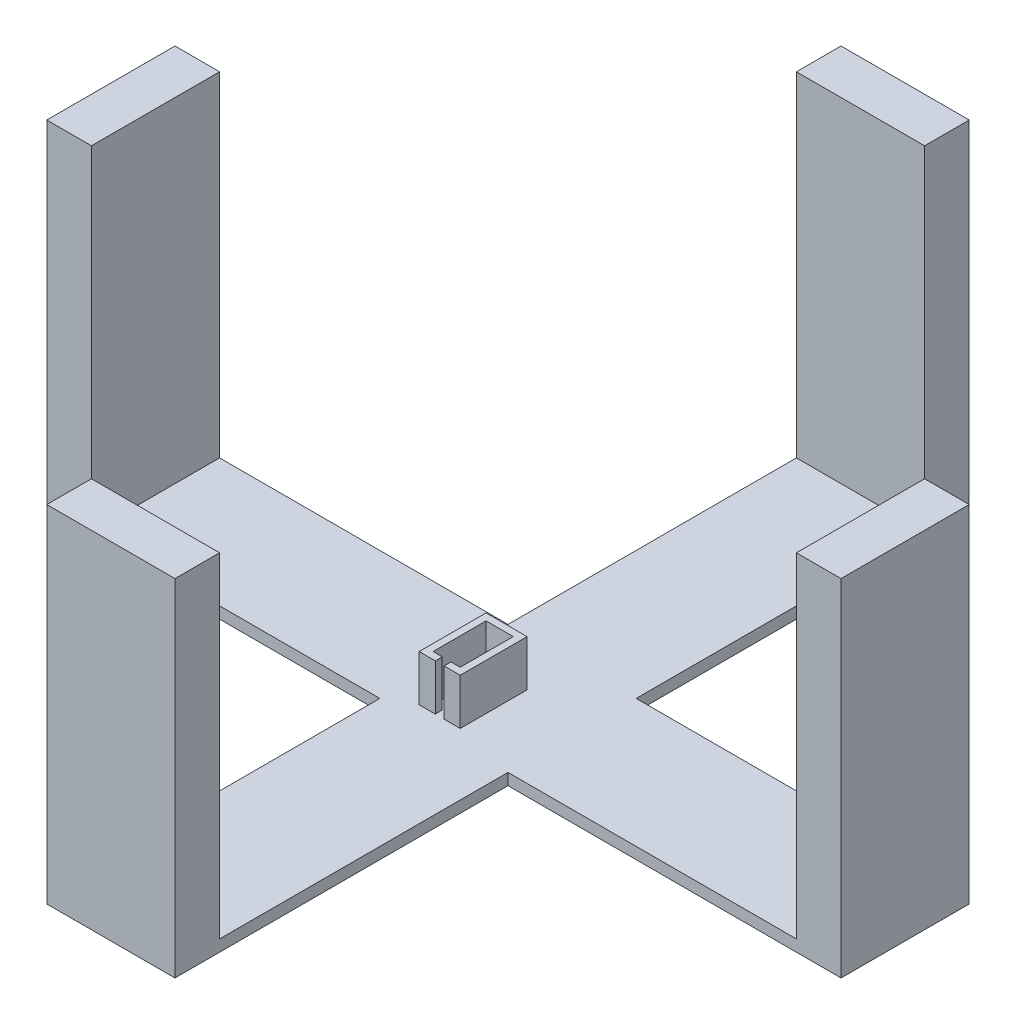
from build123d import *

# Parameters (mm, degrees)
SKETCH6_R            = 27.79
BOSS_EXTRUDE3_DEPTH  = 2
SKETCH5_W            = 125.058776632
SKETCH5_H            = 55.581678504
BOSS_EXTRUDE9_DEPTH  = 5
CIRPATTERN7_COUNT    = 4
SKETCH14_W           = 19.351012163
SKETCH14_H           = 55.581678504
BOSS_EXTRUDE10_DEPTH = 150
CIRPATTERN9_COUNT    = 4
SKETCH15_W           = 55.58
SKETCH15_H           = 55.58
BOSS_EXTRUDE11_DEPTH = 5
BOSS_EXTRUDE12_DEPTH = 25


with BuildPart() as part:
    # Sketch6 → Boss-Extrude3 (new, symmetric)
    with BuildSketch(Plane(origin=(0, 0, 0), x_dir=(1, 0, 0), z_dir=(0, 1, 0))):
        with Locations(Location((0, 0, 0), (0, 0, 270))):
            Circle(SKETCH6_R)
    extrude(amount=BOSS_EXTRUDE3_DEPTH, both=True)


with BuildPart() as body_2:
    # Sketch5 → Boss-Extrude9 (new body)
    with BuildSketch(Plane(origin=(0, 0, 0), x_dir=(1, 0, 0), z_dir=(0, 1, 0))):
        with Locations((-90.319388316, 0)):
            Rectangle(SKETCH5_W, SKETCH5_H)
    boss_extrude9 = extrude(amount=BOSS_EXTRUDE9_DEPTH)

    # CirPattern7: Boss-Extrude9 ×4 about axis
    cirpattern7_axis = Axis((0, 0, 0), (0, 1, 0))
    for i in range(1, CIRPATTERN7_COUNT):
        add(boss_extrude9.rotate(cirpattern7_axis, i * 360 / CIRPATTERN7_COUNT))

    # Sketch14 → Boss-Extrude10 (add)
    with BuildSketch(Plane(origin=(0, 0, 0), x_dir=(1, 0, 0), z_dir=(0, 1, 0))):
        with Locations((-162.524282714, 0)):
            Rectangle(SKETCH14_W, SKETCH14_H)
    boss_extrude10 = extrude(amount=BOSS_EXTRUDE10_DEPTH)

    # CirPattern9: Boss-Extrude10 ×4 about axis
    cirpattern9_axis = Axis((0, 0, 0), (0, 1, 0))
    for i in range(1, CIRPATTERN9_COUNT):
        add(boss_extrude10.rotate(cirpattern9_axis, i * 360 / CIRPATTERN9_COUNT))

    # Sketch15 → Boss-Extrude11 (add)
    with BuildSketch(Plane(origin=(0, 0, 0), x_dir=(1, 0, 0), z_dir=(0, 1, 0))):
        Rectangle(SKETCH15_W, SKETCH15_H)
    extrude(amount=BOSS_EXTRUDE11_DEPTH)

    # Sketch16 → Boss-Extrude12 (add)
    with BuildSketch(Plane(origin=(0, 0, 0), x_dir=(1, 0, 0), z_dir=(0, 1, 0))):
        Polygon((-16.866862525, 7.347575327), (0.933137475, 7.347575327), (0.933137475, -21.652424673), (-6.066862525, -21.652424673), (-6.066862525, -18.652424673), (-2.066862525, -18.652424673), (-2.066862525, 4.347575327), (-13.866862525, 4.347575327), (-13.866862525, -18.652424673), (-9.866862525, -18.652424673), (-9.866862525, -21.652424673), (-16.866862525, -21.652424673), align=None)
    extrude(amount=BOSS_EXTRUDE12_DEPTH)


solid = Compound([part.part, body_2.part])
